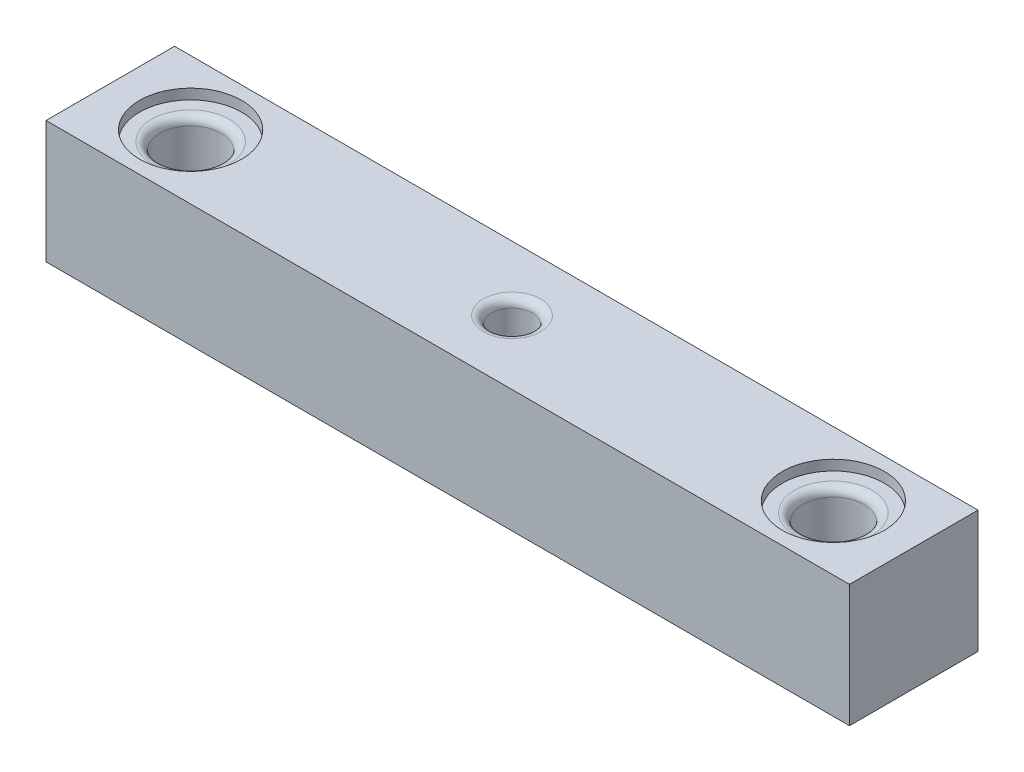
from build123d import *

# Parameters (mm, degrees)
SKETCH1_W           = 250
SKETCH1_H           = 40
SKETCH1_R           = 9.525
BOSS_EXTRUDE1_DEPTH = 38.1
SKETCH3_R           = 15.875
CUT_EXTRUDE1_DEPTH  = 3.175
SKETCH4_R           = 6.35
CUT_EXTRUDE2_DEPTH  = 133.199130103
FILLET1_R           = 2.54


with BuildPart() as part:
    # Sketch1 → Boss-Extrude1 (new body)
    with BuildSketch(Plane(origin=(0, 0, 0), x_dir=(1, 0, 0), z_dir=(0, 1, 0))):
        Rectangle(SKETCH1_W, SKETCH1_H)
        with Locations(Location((-100, 0, 0), (0, 0, 90))):
            Circle(SKETCH1_R, mode=Mode.SUBTRACT)
        with Locations(Location((100, 0, 0), (0, 0, 90))):
            Circle(SKETCH1_R, mode=Mode.SUBTRACT)
    extrude(amount=BOSS_EXTRUDE1_DEPTH)

    # Sketch3 → Cut-Extrude1 (cut)
    with BuildSketch(Plane(origin=(0, 38.1, 0), x_dir=(1, 0, 0), z_dir=(0, 1, 0))):
        with Locations(Location((-100, 0, 0), (0, 0, 270))):
            Circle(SKETCH3_R)
        with Locations(Location((100, 0, 0), (0, 0, 270))):
            Circle(SKETCH3_R)
    extrude(amount=-CUT_EXTRUDE1_DEPTH, mode=Mode.SUBTRACT)

    # Sketch4 → Cut-Extrude2 (cut, through all)
    with BuildSketch(Plane(origin=(0, 38.1, 0), x_dir=(1, 0, 0), z_dir=(0, 1, 0))):
        with Locations(Location((0, 0, 0), (0, 0, 270))):
            Circle(SKETCH4_R)
    extrude(amount=-CUT_EXTRUDE2_DEPTH, mode=Mode.SUBTRACT)

    # Fillet1
    fillet1_edges = [part.edges().sort_by_distance(p)[0] for p in [
        (-100, 34.925, 9.525),
        (100, 34.925, 9.525),
        (0, 38.1, -6.35),
    ]]
    fillet(fillet1_edges, radius=FILLET1_R)


solid = part.part
